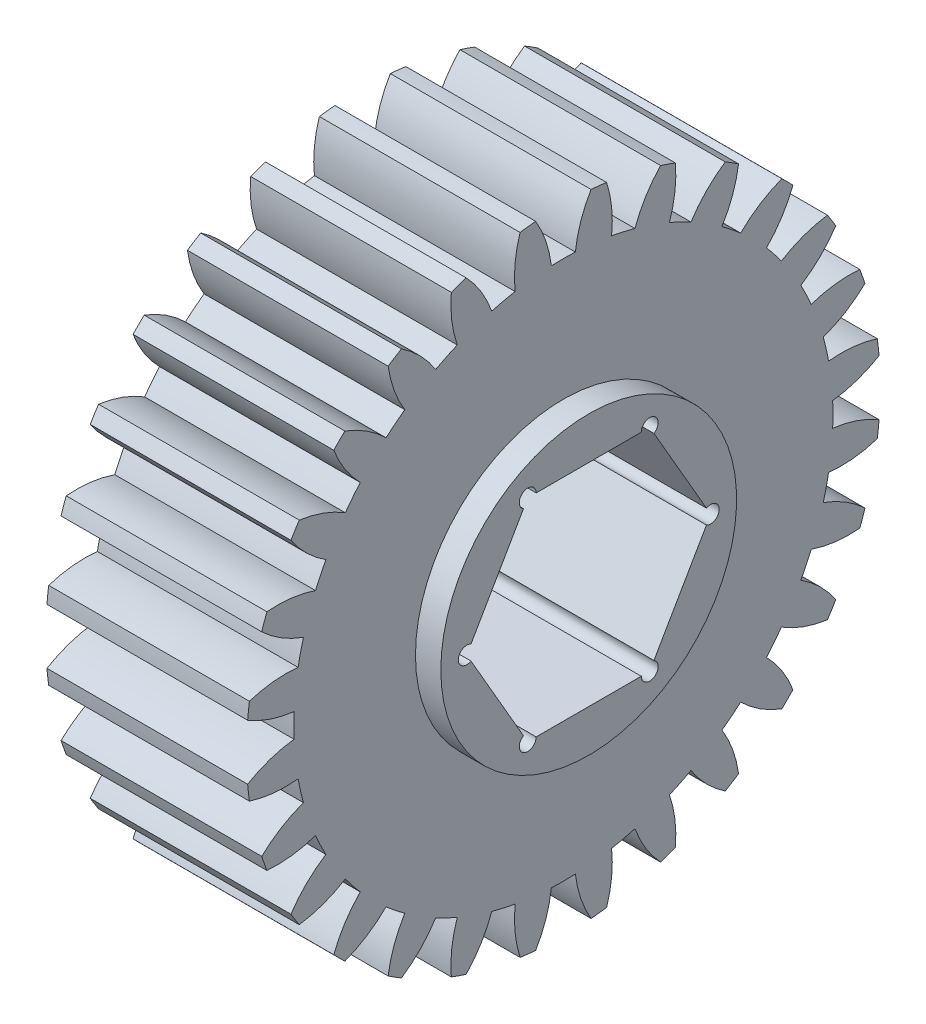
from build123d import *

# Parameters (mm, degrees)
BASPROSKE_W         = 12.065
BASPROSKE_H         = 19.05
TOOTHCUT_DEPTH      = 30.51896382
TEETHCUTS_COUNT     = 28
TEETHCUTS_ANGLE     = 347.142857143
BORSKE_R            = 1.5875
BORE_DEPTH          = 50.8000508
SKETCH1_R           = 8.89
BOSS_EXTRUDE1_DEPTH = 1.524
SKETCH2_R           = 0.508
CUT_EXTRUDE1_DEPTH  = 31.08208769


with BuildPart() as part:
    # BasProSke → Base-Revolve (revolve)
    with BuildSketch(Plane(origin=(0, 0, 0), x_dir=(1, 0, 0), z_dir=(0, 1, 0)), mode=Mode.PRIVATE) as base_revolve_sk:
        with Locations((6.0325, 9.525)):
            Rectangle(BASPROSKE_W, BASPROSKE_H)
    revolve(base_revolve_sk.sketch.rotate(Axis((-10, 0, 0), (1, 0, 0)), 180), axis=Axis((-10, 0, 0), (1, 0, 0)))

    # TooCutSke → ToothCut (cut, through all)
    with BuildSketch(Plane(origin=(0, 0, 0), x_dir=(0, 0, -1), z_dir=(1, 0, 0))):
        with BuildLine():
            ThreePointArc((0.720316391, 16.189183158), (0, 16.2052), (-0.720316391, 16.189183158))
            ThreePointArc((-0.720316391, 16.189183158), (-1.05059292, 17.645879373), (-1.677830593, 19.001467566))
            ThreePointArc((-1.677830593, 19.001467566), (0, 19.0754), (1.677830593, 19.001467566))
            ThreePointArc((1.677830593, 19.001467566), (1.05059292, 17.645879373), (0.720316391, 16.189183158))
        make_face()
    toothcut = extrude(amount=TOOTHCUT_DEPTH, mode=Mode.SUBTRACT)

    # TeethCuts: ToothCut ×28 about axis
    teethcuts_axis = Axis((-10, 0, 0), (1, 0, 0))
    for i in range(1, TEETHCUTS_COUNT):
        add(toothcut.rotate(teethcuts_axis, i * TEETHCUTS_ANGLE / (TEETHCUTS_COUNT - 1)), mode=Mode.SUBTRACT)

    # BorSke → Bore (cut, symmetric)
    with BuildSketch(Plane(origin=(0, 0, 0), x_dir=(0, 0, -1), z_dir=(1, 0, 0))):
        with Locations(Location((0, 0, 0), (0, 0, 180))):
            Circle(BORSKE_R)
    extrude(amount=BORE_DEPTH, both=True, mode=Mode.SUBTRACT)

    # Sketch1 → Boss-Extrude1 (add)
    with BuildSketch(Plane(origin=(12.065, 0, 0), x_dir=(0, 0, -1), z_dir=(1, 0, 0))):
        with Locations(Location((0, 0, 0), (0, 0, 180))):
            Circle(SKETCH1_R)
    extrude(amount=BOSS_EXTRUDE1_DEPTH)

    # Sketch2 → Cut-Extrude1 (cut, through all)
    with BuildSketch(Plane(origin=(13.589, 0, 0), x_dir=(0, 0, -1), z_dir=(1, 0, 0))):
        with BuildLine():
            ThreePointArc((-6.824348419, 0), (-6.892407514, 0.254), (-7.078348419, 0.439940905))
            Line((-7.078348419, 0.439940905), (-7.332348419, 0))
            Line((-7.332348419, 0), (-7.078348419, -0.439940905))
            ThreePointArc((-7.078348419, -0.439940905), (-6.892407514, -0.254), (-6.824348419, 0))
        make_face()
        with BuildLine():
            Line((-7.332348419, 0), (-7.078348419, 0.439940905))
            ThreePointArc((-7.078348419, 0.439940905), (-7.840348419, 0), (-7.078348419, -0.439940905))
            Line((-7.078348419, -0.439940905), (-7.332348419, 0))
        make_face()
        with Locations((-7.332348419, 0)):
            Circle(SKETCH2_R)
        with Locations((-3.666174209, -6.35)):
            Circle(SKETCH2_R)
        with Locations((3.666174209, -6.35)):
            Circle(SKETCH2_R)
        with Locations((7.332348419, 0)):
            Circle(SKETCH2_R)
        with Locations((3.666174209, 6.35)):
            Circle(SKETCH2_R)
        with Locations((-3.666174209, 6.35)):
            Circle(SKETCH2_R)
        Polygon((-7.332348419, 0), (-3.666174209, -6.35), (3.666174209, -6.35), (7.332348419, 0), (3.666174209, 6.35), (-3.666174209, 6.35), align=None)
        with BuildLine():
            ThreePointArc((-3.920174209, 5.910059095), (-3.412174209, 5.910059095), (-3.158174209, 6.35))
            Line((-3.158174209, 6.35), (-3.666174209, 6.35))
            Line((-3.666174209, 6.35), (-3.920174209, 5.910059095))
        make_face()
        with BuildLine():
            Line((-3.666174209, 6.35), (-3.158174209, 6.35))
            ThreePointArc((-3.158174209, 6.35), (-3.920174209, 6.789940905), (-3.920174209, 5.910059095))
            Line((-3.920174209, 5.910059095), (-3.666174209, 6.35))
        make_face()
        with BuildLine():
            ThreePointArc((3.158174209, 6.35), (3.412174209, 5.910059095), (3.920174209, 5.910059095))
            Line((3.920174209, 5.910059095), (3.666174209, 6.35))
            Line((3.666174209, 6.35), (3.158174209, 6.35))
        make_face()
        with BuildLine():
            Line((3.666174209, 6.35), (3.920174209, 5.910059095))
            ThreePointArc((3.920174209, 5.910059095), (4.106115114, 6.096), (4.174174209, 6.35))
            ThreePointArc((4.174174209, 6.35), (3.666174209, 6.858), (3.158174209, 6.35))
            Line((3.158174209, 6.35), (3.666174209, 6.35))
        make_face()
        with BuildLine():
            Line((7.078348419, -0.439940905), (7.332348419, 0))
            Line((7.332348419, 0), (7.078348419, 0.439940905))
            ThreePointArc((7.078348419, 0.439940905), (6.824348419, 0), (7.078348419, -0.439940905))
        make_face()
        with BuildLine():
            Line((7.078348419, 0.439940905), (7.332348419, 0))
            Line((7.332348419, 0), (7.078348419, -0.439940905))
            ThreePointArc((7.078348419, -0.439940905), (7.586348419, -0.439940905), (7.840348419, 0))
            ThreePointArc((7.840348419, 0), (7.586348419, 0.439940905), (7.078348419, 0.439940905))
        make_face()
        with BuildLine():
            ThreePointArc((4.174174209, -6.35), (4.106115114, -6.096), (3.920174209, -5.910059095))
            Line((3.920174209, -5.910059095), (3.666174209, -6.35))
            Line((3.666174209, -6.35), (3.158174209, -6.35))
            ThreePointArc((3.158174209, -6.35), (3.666174209, -6.858), (4.174174209, -6.35))
        make_face()
        with BuildLine():
            Line((3.666174209, -6.35), (3.920174209, -5.910059095))
            ThreePointArc((3.920174209, -5.910059095), (3.412174209, -5.910059095), (3.158174209, -6.35))
            Line((3.158174209, -6.35), (3.666174209, -6.35))
        make_face()
    extrude(amount=-CUT_EXTRUDE1_DEPTH, mode=Mode.SUBTRACT)


solid = part.part
